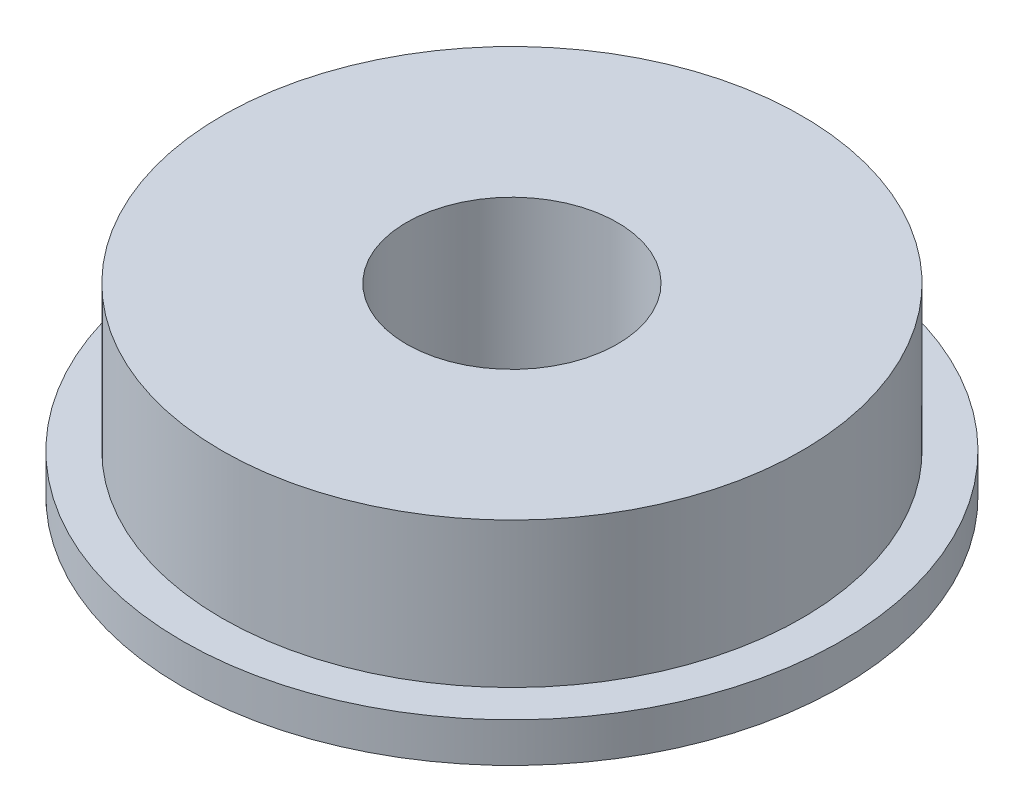
from build123d import *

# Parameters (mm, degrees)
SKETCH1_R                = 12.5
BOSS_EXTRUDE1_DEPTH      = 1.5
SKETCH2_R                = 11
BOSS_EXTRUDE2_DEPTH      = 5.5
F_8_0_8_DIAMETER_HOLE1_D = 8


with BuildPart() as part:
    # Sketch1 → Boss-Extrude1 (new body)
    with BuildSketch(Plane(origin=(0, 0, 0), x_dir=(1, 0, 0), z_dir=(0, 1, 0))):
        with Locations(Location((0, 0, 0), (0, 0, 270))):
            Circle(SKETCH1_R)
    extrude(amount=BOSS_EXTRUDE1_DEPTH)

    # Sketch2 → Boss-Extrude2 (add)
    with BuildSketch(Plane(origin=(0, 1.5, 0), x_dir=(1, 0, 0), z_dir=(0, 1, 0))):
        with Locations(Location((0, 0, 0), (0, 0, 270))):
            Circle(SKETCH2_R)
    extrude(amount=BOSS_EXTRUDE2_DEPTH)

    # Ø8.0 (8) Diameter Hole1 (through all)
    with Locations(Plane(origin=(0, 7, 0), x_dir=(1, 0, 0), z_dir=(0, 1, 0))):
        with Locations((0, 0)):
            Hole(F_8_0_8_DIAMETER_HOLE1_D / 2)


solid = part.part
